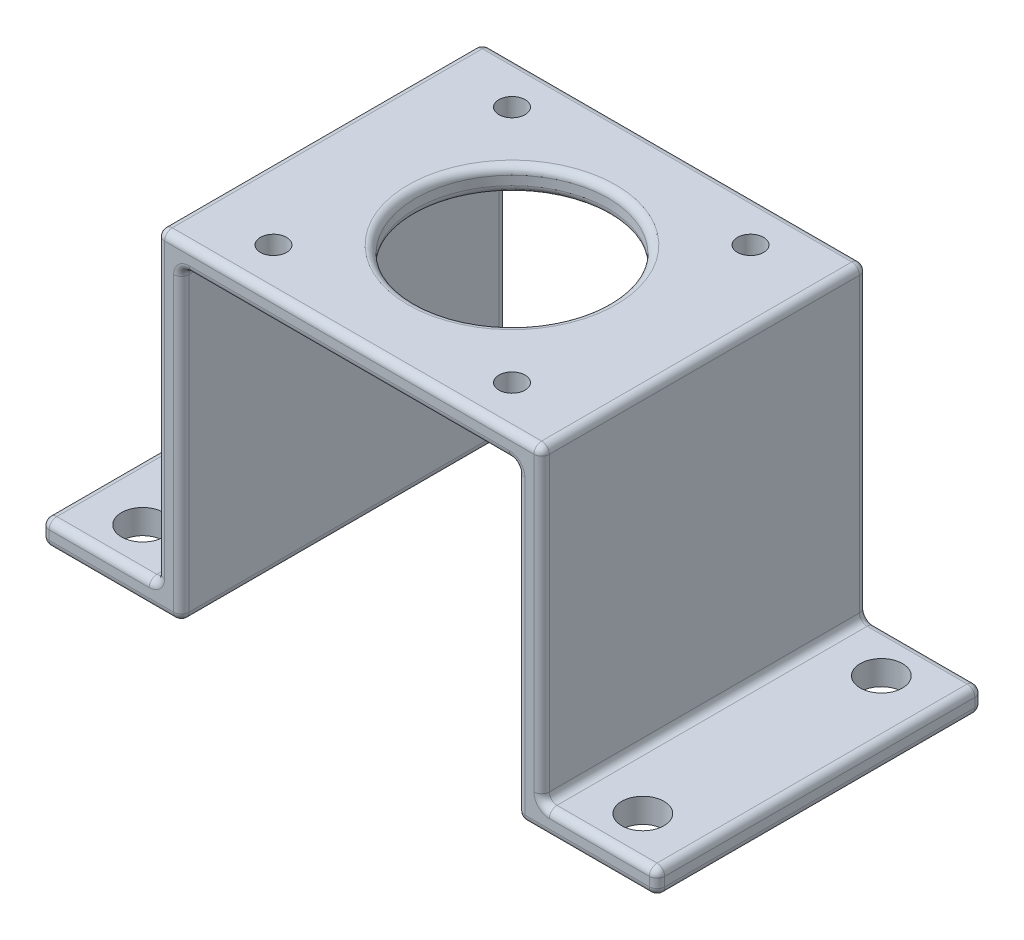
from build123d import *

# Parameters (mm, degrees)
SKETCH1_W           = 50
SKETCH1_H           = 42.3
SKETCH1_R           = 12.5
SKETCH1_R_2         = 1.7
BOSS_EXTRUDE1_DEPTH = 3.175
SKETCH2_W           = 3.175
SKETCH2_H           = 42.3
BOSS_EXTRUDE2_DEPTH = 40
SKETCH3_W           = 15
SKETCH3_H           = 42.3
SKETCH3_R           = 2.75
BOSS_EXTRUDE3_DEPTH = 3.175
FILLET1_R           = 1
FILLET2_R           = 1


with BuildPart() as part:
    # Sketch1 → Boss-Extrude1 (new body)
    with BuildSketch(Plane(origin=(0, 0, 0), x_dir=(1, 0, 0), z_dir=(0, 1, 0))):
        Rectangle(SKETCH1_W, SKETCH1_H)
        with Locations(Location((0, 0, 0), (0, 0, 270))):
            Circle(SKETCH1_R, mode=Mode.SUBTRACT)
        with Locations(Location((-15.5, 15.5, 0), (0, 0, 270))):
            Circle(SKETCH1_R_2, mode=Mode.SUBTRACT)
        with Locations(Location((15.5, 15.5, 0), (0, 0, 270))):
            Circle(SKETCH1_R_2, mode=Mode.SUBTRACT)
        with Locations(Location((15.5, -15.5, 0), (0, 0, 270))):
            Circle(SKETCH1_R_2, mode=Mode.SUBTRACT)
        with Locations(Location((-15.5, -15.5, 0), (0, 0, 270))):
            Circle(SKETCH1_R_2, mode=Mode.SUBTRACT)
    extrude(amount=BOSS_EXTRUDE1_DEPTH)

    # Sketch2 → Boss-Extrude2 (add)
    with BuildSketch(Plane.XZ):
        with Locations((-23.4125, 0)):
            Rectangle(SKETCH2_W, SKETCH2_H)
        with Locations((23.4125, 0)):
            Rectangle(SKETCH2_W, SKETCH2_H)
    extrude(amount=BOSS_EXTRUDE2_DEPTH)

    # Sketch3 → Boss-Extrude3 (add)
    # profile 1 of 2: a face of its own
    with BuildSketch(Plane.XZ.offset(40)):
        with Locations((-32.5, 0)):
            Rectangle(SKETCH3_W, SKETCH3_H)
        with Locations(Location((-32.5, 15.5, 0), (0, 0, 270))):
            Circle(SKETCH3_R, mode=Mode.SUBTRACT)
        with Locations(Location((-32.5, -15.5, 0), (0, 0, 270))):
            Circle(SKETCH3_R, mode=Mode.SUBTRACT)
    # profile 2 of 2: a face of its own
    with BuildSketch(Plane.XZ.offset(40)):
        with Locations((32.5, 0)):
            Rectangle(SKETCH3_W, SKETCH3_H)
        with Locations(Location((32.5, -15.5, 0), (0, 0, 270))):
            Circle(SKETCH3_R, mode=Mode.SUBTRACT)
        with Locations(Location((32.5, 15.5, 0), (0, 0, 270))):
            Circle(SKETCH3_R, mode=Mode.SUBTRACT)
    extrude(amount=-BOSS_EXTRUDE3_DEPTH)

    # Fillet1
    fillet1_edges = [part.edges().sort_by_distance(p)[0] for p in [
        (25, 3.175, 0),
        (0, 3.175, -21.15),
        (0, 0, 21.15),
        (-21.825, 0, 0),
        (-21.825, -20, -21.15),
        (-21.825, -20, 21.15),
        (-30.9125, -40, -21.15),
        (-21.825, -40, 0),
        (-30.9125, -40, 21.15),
        (0, 0, -21.15),
        (21.825, 0, 0),
        (21.825, -20, 21.15),
        (21.825, -20, -21.15),
        (-25, 3.175, 0),
        (30.9125, -40, 21.15),
        (21.825, -40, 0),
        (30.9125, -40, -21.15),
        (-25, -36.825, 0),
        (-32.5, -36.825, -21.15),
        (-40, -36.825, 0),
        (-40, -38.4125, -21.15),
        (-32.5, -36.825, 21.15),
        (-40, -38.4125, 21.15),
        (-40, -40, 0),
        (25, -36.825, 0),
        (32.5, -36.825, 21.15),
        (40, -36.825, 0),
        (40, -38.4125, 21.15),
        (32.5, -36.825, -21.15),
        (40, -38.4125, -21.15),
        (40, -40, 0),
        (-25, -16.825, -21.15),
        (25, -16.825, -21.15),
        (25, -16.825, 21.15),
        (-25, -16.825, 21.15),
        (0, 3.175, 21.15),
    ]]
    fillet(fillet1_edges, radius=FILLET1_R)

    # Fillet2
    fillet2_edges = [part.edges().sort_by_distance(p)[0] for p in [
        (0, 0, -12.5),
        (0, 3.175, -12.5),
    ]]
    fillet(fillet2_edges, radius=FILLET2_R)


solid = part.part
